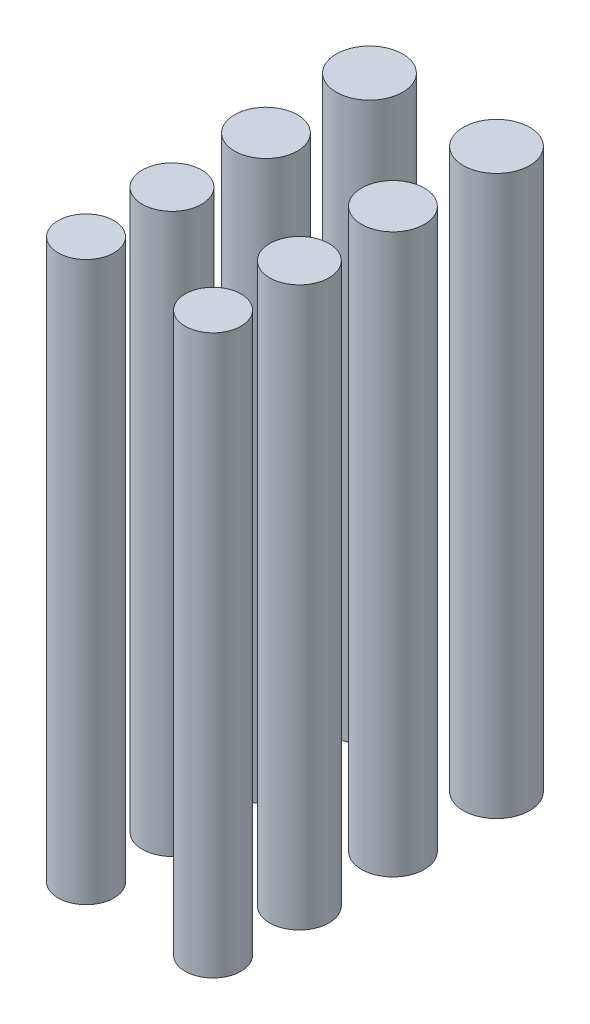
from build123d import *

# Parameters (mm, degrees)
SKETCH2_R             = 0.9
BOSS_EXTRUDE1_DEPTH   = 16
BOSS_EXTRUDE1_2_DEPTH = 16
SKETCH2_R_2           = 0.85
BOSS_EXTRUDE1_3_DEPTH = 16
BOSS_EXTRUDE1_4_DEPTH = 16
SKETCH2_R_3           = 0.8
BOSS_EXTRUDE1_5_DEPTH = 16
BOSS_EXTRUDE1_6_DEPTH = 16
SKETCH2_R_4           = 0.95
BOSS_EXTRUDE1_7_DEPTH = 16
BOSS_EXTRUDE1_8_DEPTH = 16


with BuildPart() as part:
    # Sketch2 → Boss-Extrude1 (new body)
    with BuildSketch(Plane(origin=(0, 0, 0), x_dir=(1, 0, 0), z_dir=(0, 1, 0))):
        with Locations(Location((-47.533090066, 23.083829298, 0), (0, 0, 270))):
            Circle(SKETCH2_R)
    extrude(amount=BOSS_EXTRUDE1_DEPTH)


with BuildPart() as body_2:
    # Sketch2 → Boss-Extrude1 2 (new body)
    with BuildSketch(Plane(origin=(0, 0, 0), x_dir=(1, 0, 0), z_dir=(0, 1, 0))):
        with Locations(Location((-43.896280183, 23.083829298, 0), (0, 0, 270))):
            Circle(SKETCH2_R)
    extrude(amount=BOSS_EXTRUDE1_2_DEPTH)


with BuildPart() as body_3:
    # Sketch2 → Boss-Extrude1 3 (new body)
    with BuildSketch(Plane(origin=(0, 0, 0), x_dir=(1, 0, 0), z_dir=(0, 1, 0))):
        with Locations(Location((-47.533090066, 20.392803886, 0), (0, 0, 270))):
            Circle(SKETCH2_R_2)
    extrude(amount=BOSS_EXTRUDE1_3_DEPTH)


with BuildPart() as body_4:
    # Sketch2 → Boss-Extrude1 4 (new body)
    with BuildSketch(Plane(origin=(0, 0, 0), x_dir=(1, 0, 0), z_dir=(0, 1, 0))):
        with Locations(Location((-43.885336498, 20.392803886, 0), (0, 0, 270))):
            Circle(SKETCH2_R_2)
    extrude(amount=BOSS_EXTRUDE1_4_DEPTH)


with BuildPart() as body_5:
    # Sketch2 → Boss-Extrude1 5 (new body)
    with BuildSketch(Plane(origin=(0, 0, 0), x_dir=(1, 0, 0), z_dir=(0, 1, 0))):
        with Locations(Location((-47.533090066, 17.932108277, 0), (0, 0, 270))):
            Circle(SKETCH2_R_3)
    extrude(amount=BOSS_EXTRUDE1_5_DEPTH)


with BuildPart() as body_6:
    # Sketch2 → Boss-Extrude1 6 (new body)
    with BuildSketch(Plane(origin=(0, 0, 0), x_dir=(1, 0, 0), z_dir=(0, 1, 0))):
        with Locations(Location((-43.896280183, 17.932108277, 0), (0, 0, 270))):
            Circle(SKETCH2_R_3)
    extrude(amount=BOSS_EXTRUDE1_6_DEPTH)


with BuildPart() as body_7:
    # Sketch2 → Boss-Extrude1 7 (new body)
    with BuildSketch(Plane(origin=(0, 0, 0), x_dir=(1, 0, 0), z_dir=(0, 1, 0))):
        with Locations(Location((-47.533090066, 26.049720524, 0), (0, 0, 270))):
            Circle(SKETCH2_R_4)
    extrude(amount=BOSS_EXTRUDE1_7_DEPTH)


with BuildPart() as body_8:
    # Sketch2 → Boss-Extrude1 8 (new body)
    with BuildSketch(Plane(origin=(0, 0, 0), x_dir=(1, 0, 0), z_dir=(0, 1, 0))):
        with Locations(Location((-43.896280183, 26.049720524, 0), (0, 0, 270))):
            Circle(SKETCH2_R_4)
    extrude(amount=BOSS_EXTRUDE1_8_DEPTH)


solid = Compound([part.part, body_2.part, body_3.part, body_4.part, body_5.part, body_6.part, body_7.part, body_8.part])
